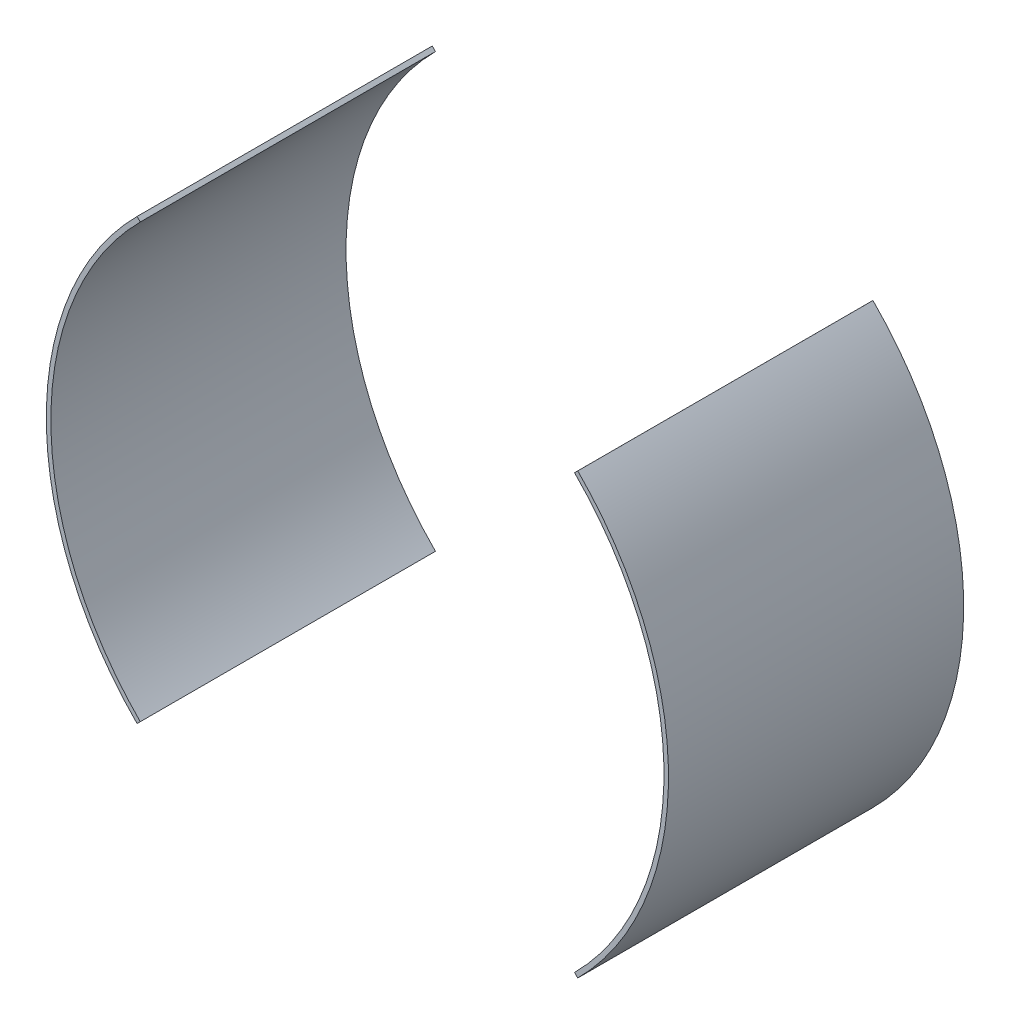
from build123d import *

# Parameters (mm, degrees)
EXTRUDE_THIN1_DEPTH   = 165.1
EXTRUDE_THIN1_2_DEPTH = 165.1


with BuildPart() as part:
    # Sketch1 → Extrude-Thin1 (new body)
    with BuildSketch(Plane.XY):
        with BuildLine():
            ThreePointArc((-123.242178868, 122.816470588), (-173.99, 0), (-123.242178868, -122.816470588))
            Line((-123.242178868, -122.816470588), (-121.443022973, -121.023529412))
            ThreePointArc((-121.443022973, -121.023529412), (-171.45, 0), (-121.443022973, 121.023529412))
            Line((-121.443022973, 121.023529412), (-123.242178868, 122.816470588))
        make_face()
    extrude(amount=EXTRUDE_THIN1_DEPTH)


with BuildPart() as body_2:
    # Sketch1 → Extrude-Thin1 2 (new body)
    with BuildSketch(Plane.XY):
        with BuildLine():
            ThreePointArc((123.242178868, -122.816470588), (173.99, 0), (123.242178868, 122.816470588))
            Line((123.242178868, 122.816470588), (121.443022973, 121.023529412))
            ThreePointArc((121.443022973, 121.023529412), (171.45, 0), (121.443022973, -121.023529412))
            Line((121.443022973, -121.023529412), (123.242178868, -122.816470588))
        make_face()
    extrude(amount=EXTRUDE_THIN1_2_DEPTH)


solid = Compound([part.part, body_2.part])
